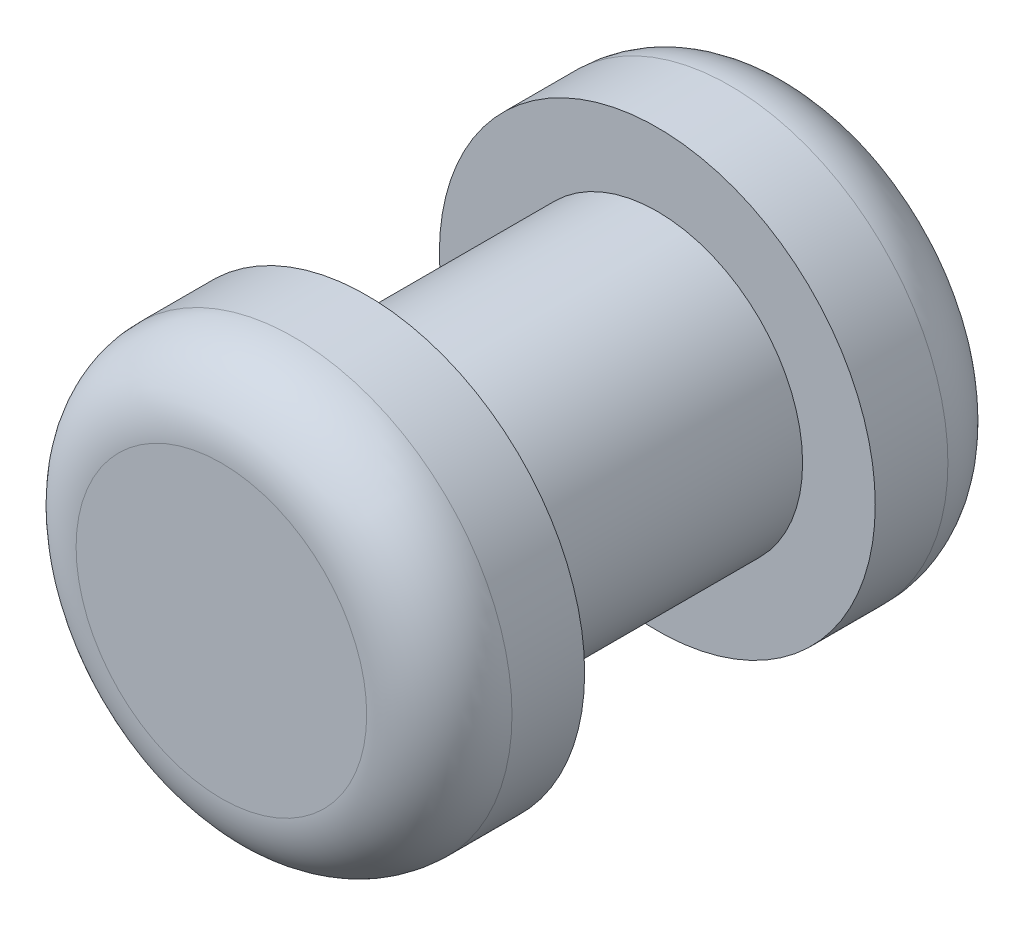
from build123d import *

# Parameters (mm, degrees)
FILLET1_R = 0.25


with BuildPart() as part:
    # Sketch1 → Revolve1 (revolve)
    with BuildSketch(Plane(origin=(0, 0, 0), x_dir=(0, 0, -1), z_dir=(1, 0, 0)), mode=Mode.PRIVATE) as revolve1_sk:
        Polygon((1, 0), (-1, 0), (-1, 0.75), (-0.5, 0.75), (-0.5, 0.5), (0.5, 0.5), (0.5, 0.75), (1, 0.75), align=None)
    revolve(revolve1_sk.sketch.rotate(Axis((0, 0, 0), (0, 0, 1)), 90), axis=Axis((0, 0, 0), (0, 0, 1)))

    # Fillet1
    fillet1_edges = [part.edges().sort_by_distance(p)[0] for p in [
        (0.75, 0, 1),
        (0.75, 0, -1),
    ]]
    fillet(fillet1_edges, radius=FILLET1_R)


solid = part.part
